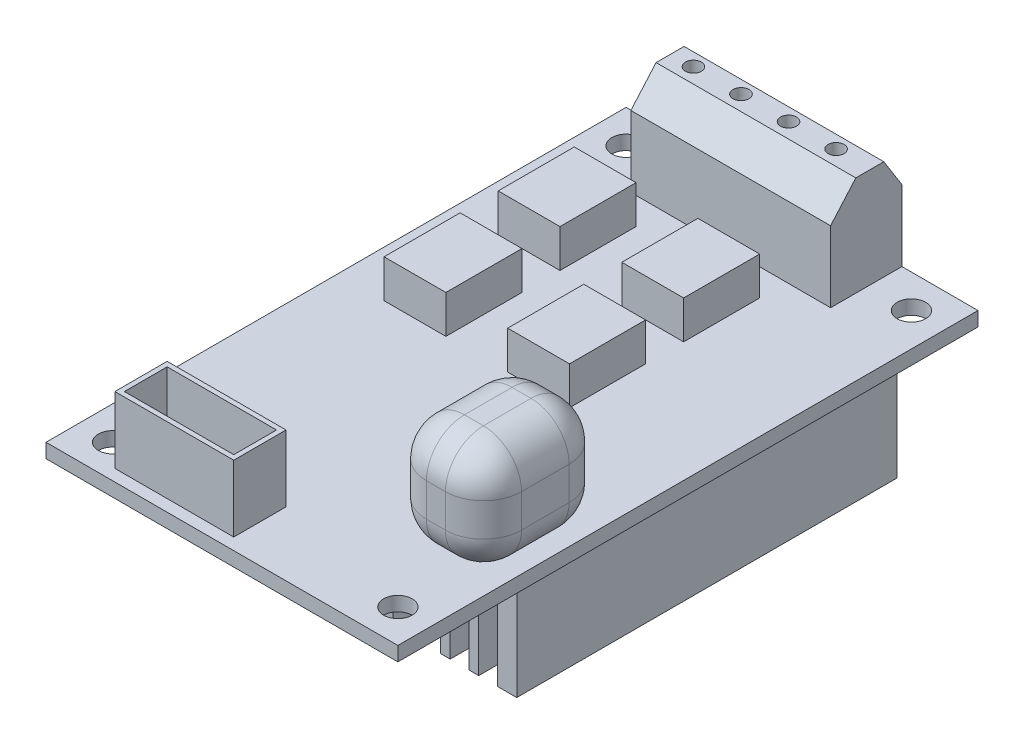
from build123d import *

# Parameters (mm, degrees)
SKETCH_1_W          = 37
SKETCH_1_H          = 61
SKETCH_1_R          = 1.5
EXTRUDE_1_DEPTH     = 1.5
SKETCH_2_W          = 35
SKETCH_2_H          = 40
EXTRUDE_2_DEPTH     = 10.5
SKETCH_3_W          = 12.5
SKETCH_3_H          = 5.5
EXTRUDE_3_DEPTH     = 7
SKETCH_4_W          = 21
SKETCH_4_H          = 7.5
EXTRUDE_4_DEPTH     = 10.5
SKETCH_5_W          = 10
SKETCH_5_H          = 13
EXTRUDE_5_DEPTH     = 11.5
SKETCH_6_W          = 11.5
SKETCH_6_H          = 4.5
CUT_EXTRUDE_1_DEPTH = 7
CUT_EXTRUDE_3_DEPTH = 21
SKETCH_9_R          = 0.84119958
CUT_EXTRUDE_4_DEPTH = 3
FILLET_2_R          = 4
SKETCH_10_W         = 6.5
SKETCH_10_H         = 8
EXTRUDE_6_DEPTH     = 4
SKETCH_11_W         = 2
SKETCH_11_H         = 10
CUT_EXTRUDE_5_DEPTH = 67.334380226


with BuildPart() as part:
    # 草图1 → 凸台-拉伸1 (new body)
    with BuildSketch(Plane(origin=(0, 0, 0), x_dir=(1, 0, 0), z_dir=(0, 1, 0))):
        with Locations((18.5, 30.5)):
            Rectangle(SKETCH_1_W, SKETCH_1_H)
        with Locations(Location((3.5, 57.5, 0), (0, 0, 270))):
            Circle(SKETCH_1_R, mode=Mode.SUBTRACT)
        with Locations(Location((33.5, 57.5, 0), (0, 0, 270))):
            Circle(SKETCH_1_R, mode=Mode.SUBTRACT)
        with Locations(Location((3.5, 3.5, 0), (0, 0, 270))):
            Circle(SKETCH_1_R, mode=Mode.SUBTRACT)
        with Locations(Location((33.5, 3.5, 0), (0, 0, 270))):
            Circle(SKETCH_1_R, mode=Mode.SUBTRACT)
    extrude(amount=EXTRUDE_1_DEPTH)

    # 草图2 → 凸台-拉伸2 (add)
    with BuildSketch(Plane.XZ):
        with Locations((18.5, -33.5)):
            Rectangle(SKETCH_2_W, SKETCH_2_H)
    extrude(amount=EXTRUDE_2_DEPTH)

    # 草图3 → 凸台-拉伸3 (add)
    with BuildSketch(Plane(origin=(0, 1.5, 0), x_dir=(1, 0, 0), z_dir=(0, 1, 0))):
        with Locations((12.25, 3.989979593)):
            Rectangle(SKETCH_3_W, SKETCH_3_H)
    extrude(amount=EXTRUDE_3_DEPTH)

    # 草图6 → 切除-拉伸1 (cut)
    with BuildSketch(Plane(origin=(0, 8.5, 0), x_dir=(1, 0, 0), z_dir=(0, 1, 0))):
        with Locations((12.25, 3.989979593)):
            Rectangle(SKETCH_6_W, SKETCH_6_H)
    extrude(amount=-CUT_EXTRUDE_1_DEPTH, mode=Mode.SUBTRACT)

    # 草图10 → 凸台-拉伸6 (add)
    with BuildSketch(Plane(origin=(0, 1.5, 0), x_dir=(1, 0, 0), z_dir=(0, 1, 0))):
        with Locations((8.130940151, 46.665513772)):
            Rectangle(SKETCH_10_W, SKETCH_10_H)
        with Locations((8.130940151, 34.665513772)):
            Rectangle(SKETCH_10_W, SKETCH_10_H)
        with Locations((21.130940151, 34.665513772)):
            Rectangle(SKETCH_10_W, SKETCH_10_H)
        with Locations((21.130940151, 46.665513772)):
            Rectangle(SKETCH_10_W, SKETCH_10_H)
    extrude(amount=EXTRUDE_6_DEPTH)

    # 草图11 → 切除-拉伸5 (cut, through all)
    with BuildSketch(Plane(origin=(0, 0, -53.5), x_dir=(-1, 0, 0), z_dir=(0, 0, -1))):
        with Locations((-33, -5.5)):
            Rectangle(SKETCH_11_W, SKETCH_11_H)
        with Locations((-30, -5.5)):
            Rectangle(SKETCH_11_W, SKETCH_11_H)
        with Locations((-27, -5.5)):
            Rectangle(SKETCH_11_W, SKETCH_11_H)
        with Locations((-24, -5.5)):
            Rectangle(SKETCH_11_W, SKETCH_11_H)
        with Locations((-21, -5.5)):
            Rectangle(SKETCH_11_W, SKETCH_11_H)
        with Locations((-18, -5.5)):
            Rectangle(SKETCH_11_W, SKETCH_11_H)
        with Locations((-15, -5.5)):
            Rectangle(SKETCH_11_W, SKETCH_11_H)
        with Locations((-12, -5.5)):
            Rectangle(SKETCH_11_W, SKETCH_11_H)
        with Locations((-9, -5.5)):
            Rectangle(SKETCH_11_W, SKETCH_11_H)
    extrude(amount=-CUT_EXTRUDE_5_DEPTH, mode=Mode.SUBTRACT)


with BuildPart() as body_2:
    # 草图4 → 凸台-拉伸4 (new body)
    with BuildSketch(Plane(origin=(0, 1.5, 0), x_dir=(1, 0, 0), z_dir=(0, 1, 0))):
        with Locations((18.5, 57.25)):
            Rectangle(SKETCH_4_W, SKETCH_4_H)
    extrude(amount=EXTRUDE_4_DEPTH)

    # 草图8 → 切除-拉伸3 (cut)
    with BuildSketch(Plane.ZY.offset(-8)):
        Polygon((-59.096067897, 12), (-61, 8.967458814), (-61, 12), align=None)
        Polygon((-56.149607192, 12), (-53.5, 8.967458814), (-53.5, 12), align=None)
    extrude(amount=-CUT_EXTRUDE_3_DEPTH, mode=Mode.SUBTRACT)

    # 草图9 → 切除-拉伸4 (cut)
    with BuildSketch(Plane(origin=(0, 12, 0), x_dir=(1, 0, 0), z_dir=(0, 1, 0))):
        with Locations(Location((25.336097721, 57.741602474, 0), (0, 0, 270))):
            Circle(SKETCH_9_R)
        with Locations(Location((20.336097721, 57.741602474, 0), (0, 0, 270))):
            Circle(SKETCH_9_R)
        with Locations(Location((15.336097721, 57.741602474, 0), (0, 0, 270))):
            Circle(SKETCH_9_R)
        with Locations(Location((10.336097721, 57.741602474, 0), (0, 0, 270))):
            Circle(SKETCH_9_R)
    extrude(amount=-CUT_EXTRUDE_4_DEPTH, mode=Mode.SUBTRACT)


with BuildPart() as body_3:
    # 草图5 → 凸台-拉伸5 (new body)
    with BuildSketch(Plane(origin=(0, 1.5, 0), x_dir=(1, 0, 0), z_dir=(0, 1, 0))):
        with Locations((32, 15.5)):
            Rectangle(SKETCH_5_W, SKETCH_5_H)
    extrude(amount=EXTRUDE_5_DEPTH)

    # 圆角2
    fillet_2_edges = [body_3.edges().sort_by_distance(p)[0] for p in [
        (27, 13, -15.5),
        (32, 13, -9),
        (37, 13, -15.5),
        (32, 1.5, -9),
        (27, 1.5, -15.5),
        (32, 1.5, -22),
        (37, 1.5, -15.5),
        (32, 13, -22),
        (37, 7.25, -9),
        (27, 7.25, -9),
        (27, 7.25, -22),
        (37, 7.25, -22),
    ]]
    fillet(fillet_2_edges, radius=FILLET_2_R)


solid = Compound([part.part, body_2.part, body_3.part])
